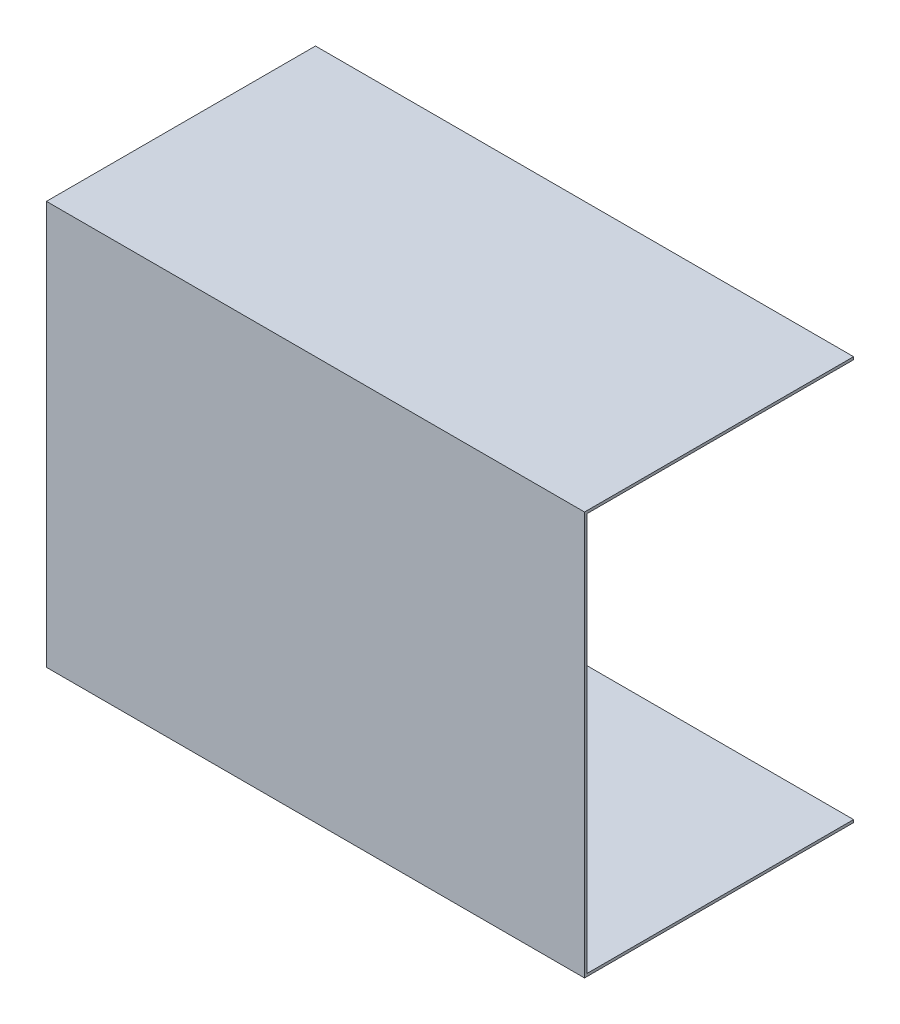
from build123d import *

# Parameters (mm, degrees)
SKETCH_1_W      = 2000
SKETCH_1_H      = 1000
EXTRUDE_1_DEPTH = 1500
SHELL_1_T       = -10


with BuildPart() as part:
    # 草图1 → 凸台-拉伸1 (new body)
    with BuildSketch(Plane(origin=(0, 0, 0), x_dir=(1, 0, 0), z_dir=(0, 1, 0))):
        Rectangle(SKETCH_1_W, SKETCH_1_H)
    extrude(amount=EXTRUDE_1_DEPTH)

    # 抽壳1
    shell_1_openings = [part.faces().sort_by_distance(p)[0] for p in [
        (0, 750, -500),
        (1000, 750, 0),
    ]]
    offset(amount=SHELL_1_T, openings=shell_1_openings, kind=Kind.INTERSECTION)


solid = part.part
